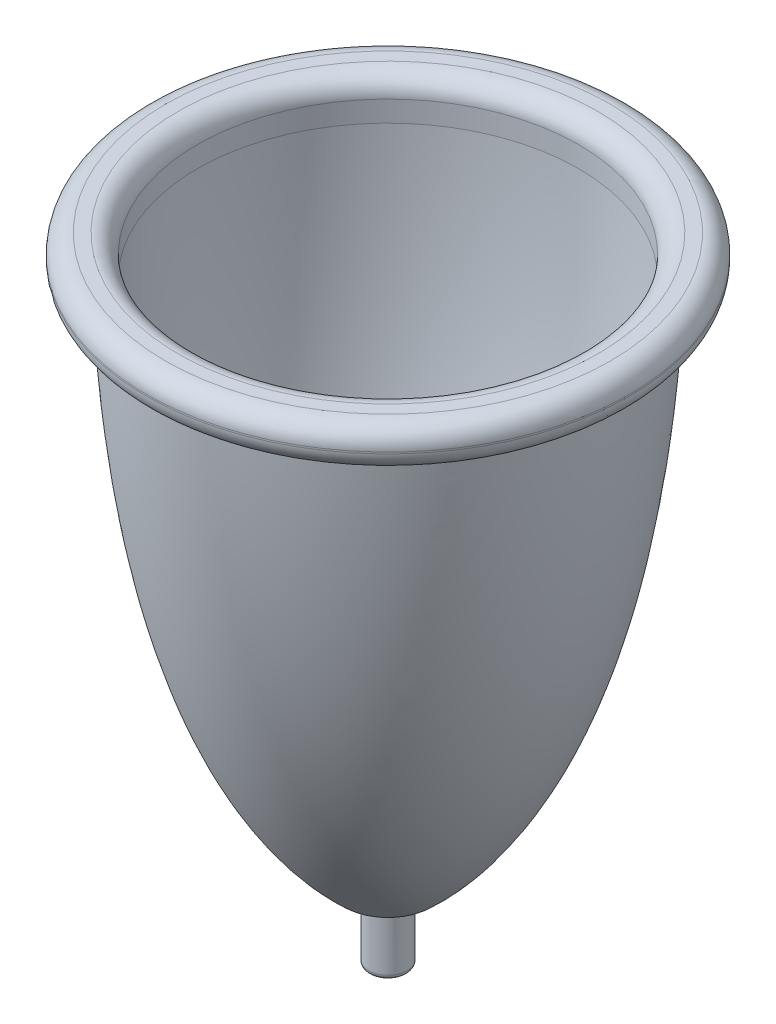
from build123d import *

# Parameters (mm, degrees)
FILLET1_R = 2
FILLET3_R = 0.5
FILLET4_R = 0.5


with BuildPart() as part:
    # Sketch1 → Revolve1 (revolve)
    with BuildSketch(Plane(origin=(0, 0, 0), x_dir=(0, 0, -1), z_dir=(1, 0, 0))):
        with BuildLine():
            Line((0, 2), (0, -7))
            Line((0, -7), (2, -7))
            Line((2, -7), (2, 0))
            Line((2, 0), (4, 0))
            add(Edge.make_bspline(
                [(21.848703267, 54.833178065), (20.214258964, 14.09783204), (4, 0)],
                knots=[0.006884315, 0.006884315, 0.006884315, 1, 1, 1], degree=2))
            Line((21.848703267, 54.833178065), (23.147078708, 54.833178065))
            ThreePointArc((23.147078708, 54.833178065), (24.561292271, 55.418964503), (25.147078708, 56.833178065))
            Line((25.147078708, 56.833178065), (25.147078708, 57))
            ThreePointArc((25.147078708, 57), (24.561292271, 58.414213562), (23.147078708, 59))
            Line((23.147078708, 59), (21.847078708, 59))
            ThreePointArc((21.847078708, 59), (20.432865146, 58.414213562), (19.847078708, 57))
            Line((19.847078708, 57), (19.847078708, 54.833178065))
            add(Edge.make_bspline(
                [(19.847078708, 54.833178065), (19.814040857, 54.017540164), (19.737781594, 52.37465154), (19.550424442, 49.186834111), (19.248311129, 45.319379985), (18.778323152, 40.887379901), (18.008721168, 35.249773199), (16.78017666, 28.716739118), (14.885227728, 21.701552484), (12.578537237, 15.513730706), (9.869874942, 10.151102105), (7.293019558, 6.368464088), (5.034228182, 3.736482073), (3.856666686, 2.56580673), (3.237972307, 2)],
                knots=[0.007871339, 0.007871339, 0.007871339, 0.007871339, 0.038308261, 0.068745183, 0.129619026, 0.19049287, 0.251366713, 0.3731144, 0.494862087, 0.616609774, 0.73835746, 0.860105147, 0.920978991, 0.981852834, 0.981852834, 0.981852834, 0.981852834], degree=3))
            Line((3.237972307, 2), (0, 2))
        make_face()
    revolve(axis=Axis((0, -7, 0), (0, 1, 0)))

    # Fillet1
    fillet1_edges = [part.edges().sort_by_distance(p)[0] for p in [
        (0, 0, 4),
    ]]
    fillet(fillet1_edges, radius=FILLET1_R)

    # Fillet3
    fillet3_edges = [part.edges().sort_by_distance(p)[0] for p in [
        (0, -7, 2),
    ]]
    fillet(fillet3_edges, radius=FILLET3_R)

    # Fillet4
    fillet4_edges = [part.edges().sort_by_distance(p)[0] for p in [
        (0, 54.833178065, 21.848703267),
    ]]
    fillet(fillet4_edges, radius=FILLET4_R)


solid = part.part
